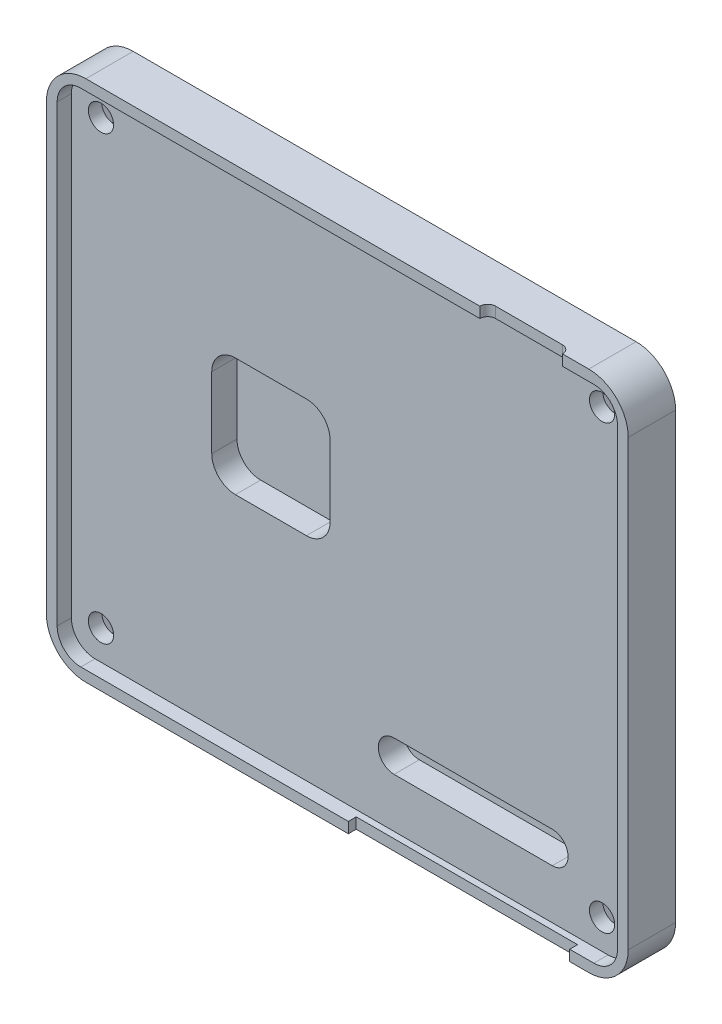
from build123d import *

# Parameters (mm, degrees)
SKETCH_1_W          = 73.73
SKETCH_1_H          = 66.24
EXTRUDE_1_DEPTH     = 6
CUT_EXTRUDE_1_DEPTH = 1.8
SKETCH_5_R          = 1.6
CUT_EXTRUDE_2_DEPTH = 100.204286702
CUT_EXTRUDE_3_DEPTH = 3.2
CUT_EXTRUDE_7_DEPTH = 9
SKETCH_11_W         = 28.050882838
SKETCH_11_H         = 1
CUT_EXTRUDE_8_DEPTH = 9
FILLET_1_R          = 5
CUT_EXTRUDE_9_DEPTH = 2.5


with BuildPart() as part:
    # 草图1 → 凸台-拉伸1 (new body)
    with BuildSketch(Plane.XY):
        with Locations((36.865, 33.12)):
            Rectangle(SKETCH_1_W, SKETCH_1_H)
    extrude(amount=EXTRUDE_1_DEPTH)

    # 草图2 → 切除-拉伸1 (cut)
    with BuildSketch(Plane.XY.offset(6)):
        with BuildLine():
            Line((4.36, 1.36), (69.37, 1.36))
            ThreePointArc((69.37, 1.36), (71.491320344, 2.238679656), (72.37, 4.36))
            Line((72.37, 4.36), (72.37, 61.88))
            ThreePointArc((72.37, 61.88), (71.491320344, 64.001320344), (69.37, 64.88))
            Line((69.37, 64.88), (4.36, 64.88))
            ThreePointArc((4.36, 64.88), (2.238679656, 64.001320344), (1.36, 61.88))
            Line((1.36, 61.88), (1.36, 4.36))
            ThreePointArc((1.36, 4.36), (2.238679656, 2.238679656), (4.36, 1.36))
        make_face()
    extrude(amount=-CUT_EXTRUDE_1_DEPTH, mode=Mode.SUBTRACT)

    # 草图5 → 切除-拉伸2 (cut, through all)
    with BuildSketch(Plane.XY.offset(4.2)):
        with Locations((5.115, 61.125)):
            Circle(SKETCH_5_R)
        with Locations(Location((68.615, 61.125, 0), (0, 0, 180))):
            Circle(SKETCH_5_R)
        with Locations((68.615, 5.115)):
            Circle(SKETCH_5_R)
        with Locations(Location((5.115, 5.115, 0), (0, 0, 180))):
            Circle(SKETCH_5_R)
    extrude(amount=-CUT_EXTRUDE_2_DEPTH, mode=Mode.SUBTRACT)

    # 草图6 → 切除-拉伸3 (cut)
    with BuildSketch(Plane.XY.offset(4.2)):
        with BuildLine():
            Line((62.307968064, 7.621116118), (42.256964224, 7.621116118))
            ThreePointArc((42.256964224, 7.621116118), (40.256964224, 9.621116118), (42.256964224, 11.621116118))
            Line((42.256964224, 11.621116118), (62.307968064, 11.621116118))
            ThreePointArc((62.307968064, 11.621116118), (64.307968064, 9.621116118), (62.307968064, 7.621116118))
        make_face()
        with BuildLine():
            Line((31.151031925, 43.266827275), (22.151031925, 43.266827275))
            ThreePointArc((22.151031925, 43.266827275), (20.029711582, 42.388147618), (19.151031925, 40.266827275))
            Line((19.151031925, 40.266827275), (19.151031925, 31.266827275))
            ThreePointArc((19.151031925, 31.266827275), (20.029711582, 29.145506931), (22.151031925, 28.266827275))
            Line((22.151031925, 28.266827275), (31.151031925, 28.266827275))
            ThreePointArc((31.151031925, 28.266827275), (33.272352269, 29.145506931), (34.151031925, 31.266827275))
            Line((34.151031925, 31.266827275), (34.151031925, 40.266827275))
            ThreePointArc((34.151031925, 40.266827275), (33.272352269, 42.388147618), (31.151031925, 43.266827275))
        make_face()
    extrude(amount=-CUT_EXTRUDE_3_DEPTH, mode=Mode.SUBTRACT)

    # 草图10 → 切除-拉伸7 (cut)
    with BuildSketch(Plane(origin=(0, 66.24, 0), x_dir=(1, 0, 0), z_dir=(0, 1, 0))):
        with BuildLine():
            Line((55.921832213, -5), (64.401832207, -5))
            ThreePointArc((64.401832207, -5), (65.108938988, -5.292893219), (65.401832207, -6))
            Line((65.401832207, -6), (54.921832213, -6))
            ThreePointArc((54.921832213, -6), (55.214725431, -5.292893219), (55.921832213, -5))
        make_face()
    extrude(amount=-CUT_EXTRUDE_7_DEPTH, mode=Mode.SUBTRACT)

    # 草图11 → 切除-拉伸8 (cut)
    with BuildSketch(Plane.XZ):
        with Locations((52.282673484, 5.5)):
            Rectangle(SKETCH_11_W, SKETCH_11_H)
    extrude(amount=-CUT_EXTRUDE_8_DEPTH, mode=Mode.SUBTRACT)

    # 圆角1
    fillet_1_edges = [part.edges().sort_by_distance(p)[0] for p in [
        (0, 66.24, 3),
        (73.73, 66.24, 3),
        (73.73, 0, 3),
        (0, 0, 3),
    ]]
    fillet(fillet_1_edges, radius=FILLET_1_R)

    # 草图12 → 切除-拉伸9 (cut)
    with BuildSketch(Plane(origin=(0, 0, 0), x_dir=(-1, 0, 0), z_dir=(0, 0, -1))):
        Polygon((-65.150898385, 61.125), (-66.882949192, 64.125), (-70.347050808, 64.125), (-72.079101615, 61.125), (-70.347050808, 58.125), (-66.882949192, 58.125), align=None)
        Polygon((-65.150898385, 5.115), (-66.882949192, 8.115), (-70.347050808, 8.115), (-72.079101615, 5.115), (-70.347050808, 2.115), (-66.882949192, 2.115), align=None)
        Polygon((-1.650898385, 5.115), (-3.382949192, 8.115), (-6.847050808, 8.115), (-8.579101615, 5.115), (-6.847050808, 2.115), (-3.382949192, 2.115), align=None)
        Polygon((-1.650898385, 61.125), (-3.382949192, 64.125), (-6.847050808, 64.125), (-8.579101615, 61.125), (-6.847050808, 58.125), (-3.382949192, 58.125), align=None)
    extrude(amount=-CUT_EXTRUDE_9_DEPTH, mode=Mode.SUBTRACT)


solid = part.part
